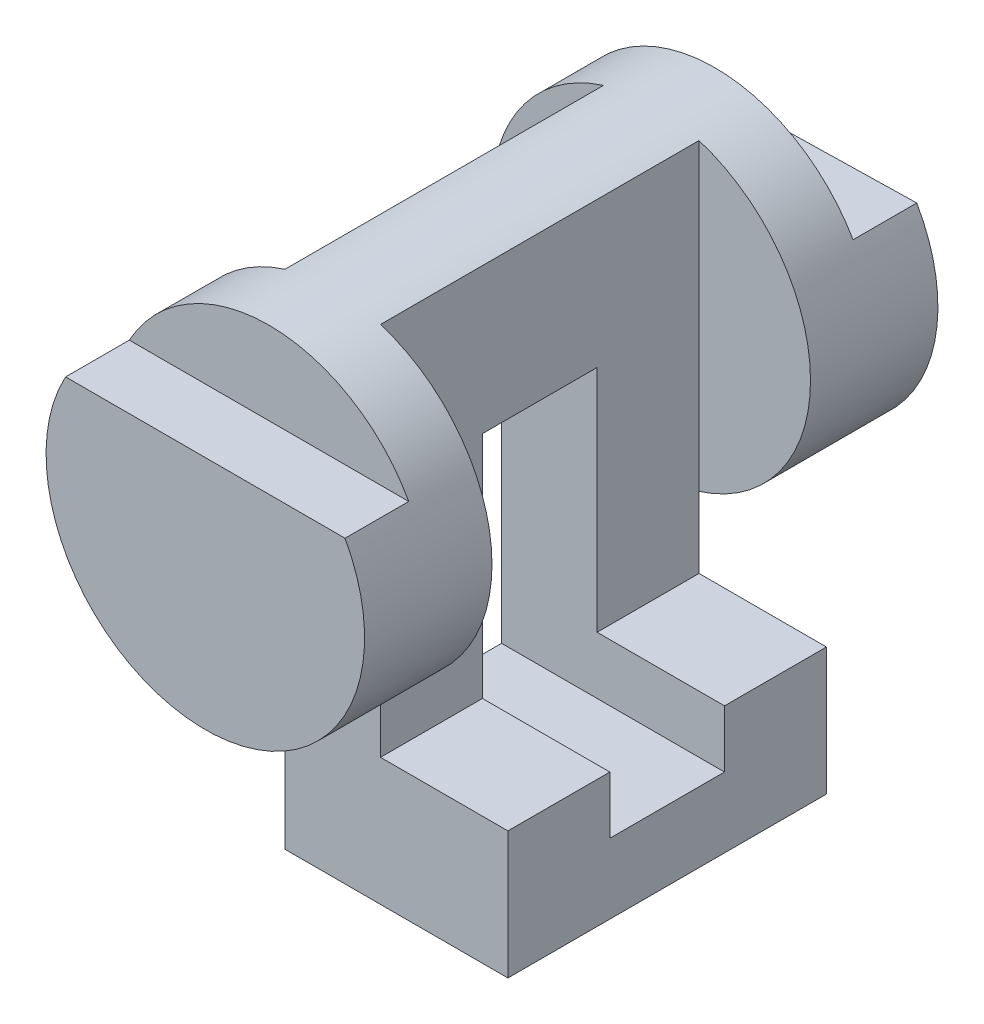
from build123d import *

# Parameters (mm, degrees)
BOSS_EXTRUDE1_DEPTH = 20
BOSS_EXTRUDE2_DEPTH = 50
SKETCH3_W           = 18
SKETCH3_H           = 45
CUT_EXTRUDE1_DEPTH  = 50
SKETCH4_R           = 25
BOSS_EXTRUDE3_DEPTH = 20
CUT_EXTRUDE2_START  = -10
CUT_EXTRUDE2_DEPTH  = 10
BOSS_EXTRUDE4_START = 50
BOSS_EXTRUDE4_DEPTH = 50
BOSS_EXTRUDE5_START = 20
SKETCH7_R           = 25
BOSS_EXTRUDE5_DEPTH = 20
CUT_EXTRUDE3_DEPTH  = 10


with BuildPart() as part:
    # Sketch1 → Boss-Extrude1 (new body)
    with BuildSketch(Plane(origin=(0, 0, 0), x_dir=(0, 0, -1), z_dir=(1, 0, 0))):
        Polygon((-22.633744856, 0), (-22.633744856, -20), (27.366255144, -20), (27.366255144, 0), (11.366255144, 0), (11.366255144, -9), (-6.633744856, -9), (-6.633744856, 0), align=None)
    extrude(amount=-BOSS_EXTRUDE1_DEPTH)

    # Sketch2 → Boss-Extrude2 (add)
    with BuildSketch(Plane.XY.offset(22.633744856)):
        Polygon((-20, 0), (-20, 54), (-35, 54), (-35, -20), (-20, -20), align=None)
    extrude(amount=-BOSS_EXTRUDE2_DEPTH)

    # Sketch3 → Cut-Extrude1 (cut)
    with BuildSketch(Plane(origin=(-20, 0, 0), x_dir=(0, 0, -1), z_dir=(1, 0, 0))):
        with Locations((2.366255144, 13.5)):
            Rectangle(SKETCH3_W, SKETCH3_H)
    extrude(amount=-CUT_EXTRUDE1_DEPTH, mode=Mode.SUBTRACT)

    # Sketch4 → Boss-Extrude3 (add)
    with BuildSketch(Plane.XY.offset(22.633744856)):
        with Locations(Location((-27.5, 35, 0), (0, 0, 252.542396876))):
            Circle(SKETCH4_R)
    extrude(amount=BOSS_EXTRUDE3_DEPTH)

    # Sketch5 → Cut-Extrude2 (cut)
    with BuildSketch(Plane.XY.offset(42.633744856).offset(CUT_EXTRUDE2_START)):
        with BuildLine():
            Line((-49.431712199, 47), (-5.568287801, 47))
            ThreePointArc((-5.568287801, 47), (-27.5, 60), (-49.431712199, 47))
        make_face()
    extrude(amount=CUT_EXTRUDE2_DEPTH, mode=Mode.SUBTRACT)

    # Sketch6 → Boss-Extrude4 (add)
    with BuildSketch(Plane(origin=(0, 0, 22.633744856), x_dir=(-1, 0, 0), z_dir=(0, 0, -1)).offset(BOSS_EXTRUDE4_START)):
        with BuildLine():
            Line((20, 54), (20, 58.848480035))
            ThreePointArc((20, 58.848480035), (27.5, 60), (35, 58.848480035))
            Line((35, 58.848480035), (35, 54))
            Line((35, 54), (20, 54))
        make_face()
    extrude(amount=-BOSS_EXTRUDE4_DEPTH)

    # Sketch7 → Boss-Extrude5 (add)
    with BuildSketch(Plane(origin=(0, 0, -27.366255144), x_dir=(-1, 0, 0), z_dir=(0, 0, -1)).offset(BOSS_EXTRUDE5_START)):
        with Locations((27.5, 35)):
            Circle(SKETCH7_R)
    extrude(amount=-BOSS_EXTRUDE5_DEPTH)

    # Sketch8 → Cut-Extrude3 (cut)
    with BuildSketch(Plane(origin=(0, 0, -47.366255144), x_dir=(-1, 0, 0), z_dir=(0, 0, -1))):
        with BuildLine():
            Line((5.820728213, 47.450268061), (49.674802071, 46.544615764))
            ThreePointArc((49.674802071, 46.544615764), (28.016177379, 59.99467065), (5.820728213, 47.450268061))
        make_face()
    extrude(amount=-CUT_EXTRUDE3_DEPTH, mode=Mode.SUBTRACT)


solid = part.part
